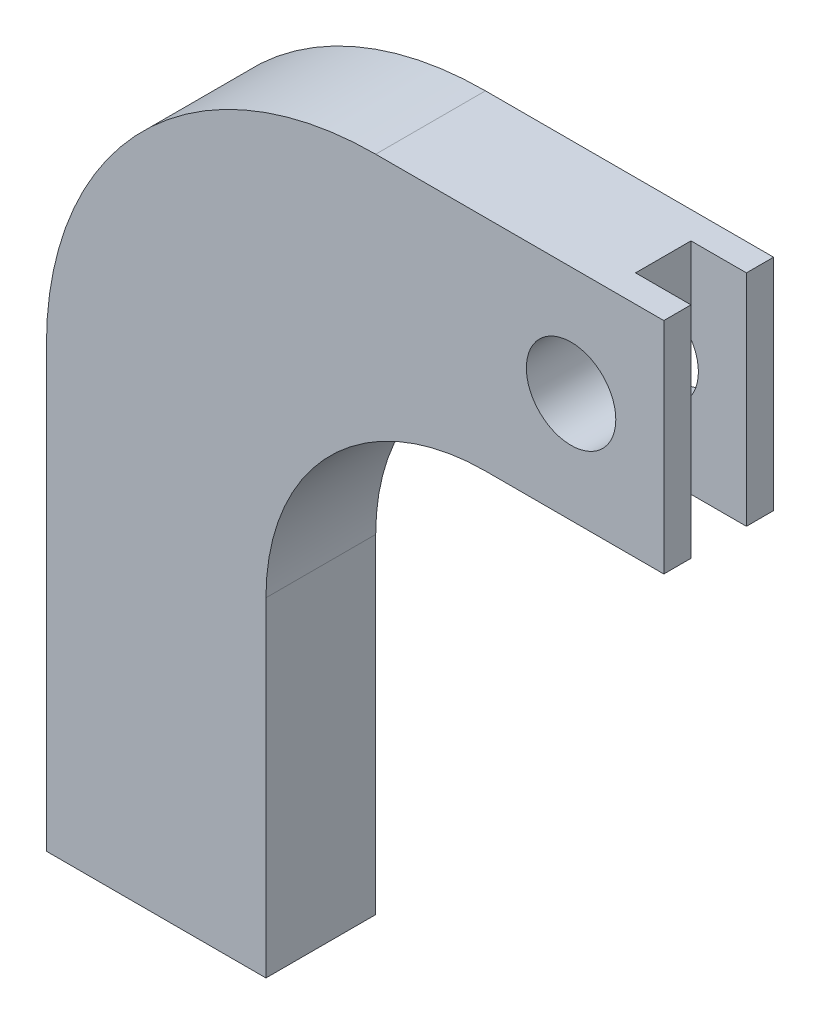
from build123d import *

# Parameters (mm, degrees)
SKETCH1_R           = 0.815
BOSS_EXTRUDE1_DEPTH = 1
SKETCH2_W           = 1.01
SKETCH2_H           = 4
CUT_EXTRUDE1_DEPTH  = 1.01


with BuildPart() as part:
    # Sketch1 → Boss-Extrude1 (new, symmetric)
    with BuildSketch(Plane.XY):
        with BuildLine():
            Line((0, 0), (0, 8))
            ThreePointArc((0, 8), (1.757359313, 12.242640687), (6, 14))
            Line((6, 14), (11.25, 14))
            Line((11.25, 14), (11.25, 10))
            Line((11.25, 10), (8, 10))
            ThreePointArc((8, 10), (5.171572875, 8.828427125), (4, 6))
            Line((4, 6), (4, 0))
            Line((4, 0), (0, 0))
        make_face()
        with Locations((9.56, 12)):
            Circle(SKETCH1_R, mode=Mode.SUBTRACT)
    extrude(amount=BOSS_EXTRUDE1_DEPTH, both=True)

    # Sketch2 → Cut-Extrude1 (cut)
    with BuildSketch(Plane(origin=(11.25, 0, 0), x_dir=(0, 0, -1), z_dir=(1, 0, 0))):
        with Locations((0, 12)):
            Rectangle(SKETCH2_W, SKETCH2_H)
    extrude(amount=-CUT_EXTRUDE1_DEPTH, mode=Mode.SUBTRACT)


solid = part.part
